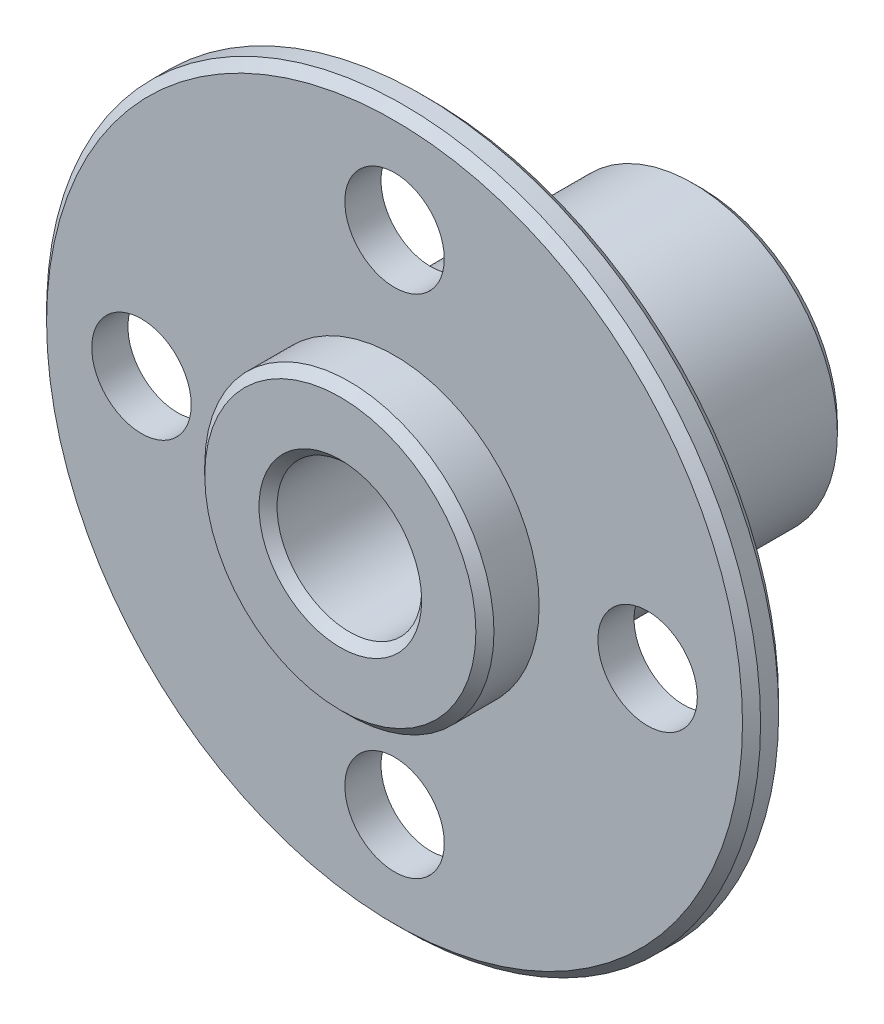
from build123d import *

# Parameters (mm, degrees)
SKETCH_1_R              = 19.75
EXTRUDE_1_DEPTH         = 2
SKETCH_2_R              = 8
EXTRUDE_2_DEPTH         = 3
EXTRUDE_START           = 15
SKETCH_3_R              = 8
EXTRUDE_3_DEPTH         = 15
HOLE_WIZARD_M8_1_D      = 8
HOLE_WIZARD_5_5_5_5_1_D = 5.5
CHAMFER_1_SIZE          = 0.5


with BuildPart() as part:
    # 草图1 → 凸台-拉伸1 (new body)
    with BuildSketch(Plane.XY):
        Circle(SKETCH_1_R)
    extrude(amount=EXTRUDE_1_DEPTH)

    # 草图2 → 凸台-拉伸2 (add)
    with BuildSketch(Plane.XY.offset(2)):
        Circle(SKETCH_2_R)
    extrude(amount=EXTRUDE_2_DEPTH)

    # 草图3 → 凸台-拉伸3 (add)
    with BuildSketch(Plane(origin=(0, 0, 0), x_dir=(-1, 0, 0), z_dir=(0, 0, -1)).offset(EXTRUDE_START)):
        with Locations(Location((0, 0, 0), (0, 0, 180))):
            Circle(SKETCH_3_R)
    extrude(amount=-EXTRUDE_3_DEPTH)

    # M8 螺纹孔1 (through all)
    with Locations(Plane.XY.offset(5)):
        with Locations((0, 0)):
            Hole(HOLE_WIZARD_M8_1_D / 2)

    # Ø5.5 (5.5) 直径孔1 (through all)
    with Locations(Plane.XY.offset(2)):
        with Locations((0, 14), (0, -14), (-14, 0), (14, 0)):
            Hole(HOLE_WIZARD_5_5_5_5_1_D / 2)

    # 倒角1
    chamfer_1_edges = [part.edges().sort_by_distance(p)[0] for p in [
        (-8, 0, -15),
        (4, 0, 5),
        (4, 0, -15),
        (-19.75, 0, 0),
        (-19.75, 0, 2),
        (-8, 0, 5),
    ]]
    chamfer(chamfer_1_edges, length=CHAMFER_1_SIZE)


solid = part.part
